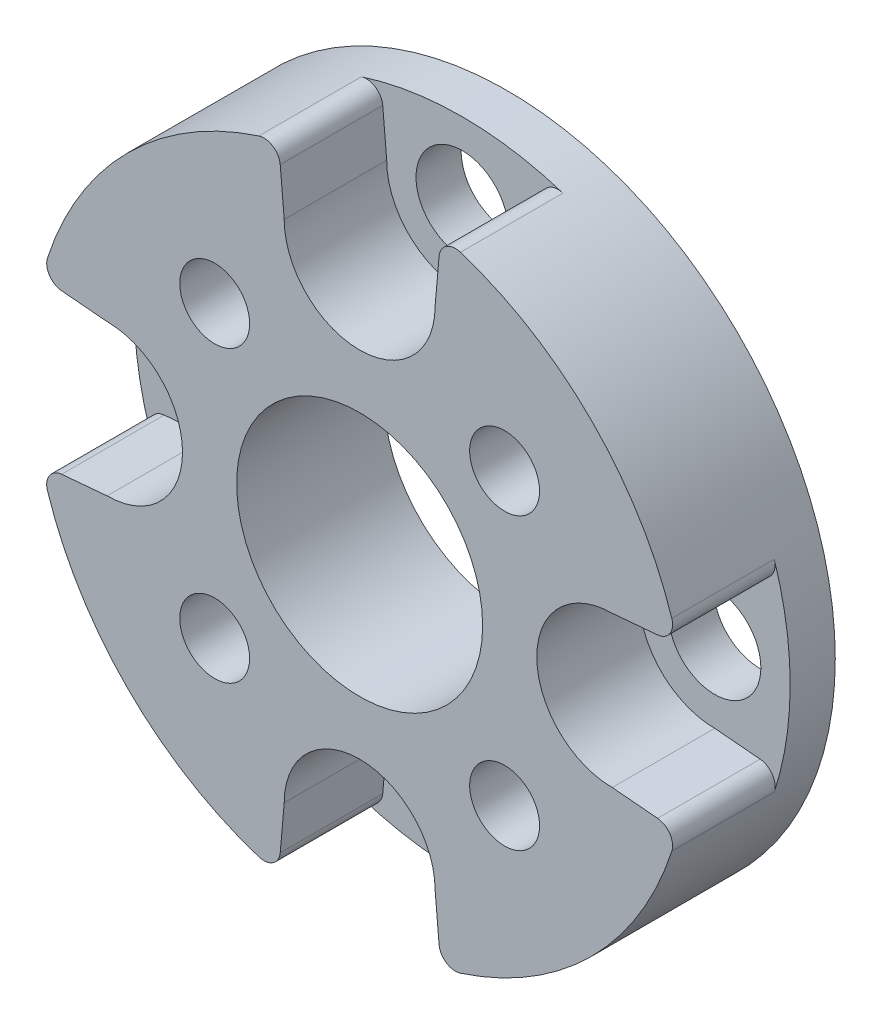
from build123d import *

# Parameters (mm, degrees)
SKETCH1_R                       = 12.7
SKETCH1_R_2                     = 4.7625
BOSS_EXTRUDE1_DEPTH             = 2.8575
F_6_32_TAPPED_HOLE1_D           = 2.7051
CUT_EXTRUDE1_DEPTH              = 3.96875
F_9_64_0_14063_DIAMETER_HOLE1_D = 3.572002
FILLET1_R                       = 0.635


with BuildPart() as part:
    # Sketch1 → Boss-Extrude1 (new, symmetric)
    with BuildSketch(Plane.XY):
        Circle(SKETCH1_R)
        Circle(SKETCH1_R_2, mode=Mode.SUBTRACT)
    extrude(amount=BOSS_EXTRUDE1_DEPTH, both=True)

    # #6-32 Tapped Hole1 (through all)
    with Locations(Plane.XY.offset(2.8575)):
        with Locations((5.612660076, 5.612660076), (5.612660076, -5.612660076), (-5.612660076, -5.612660076), (-5.612660076, 5.612660076)):
            Hole(F_6_32_TAPPED_HOLE1_D / 2)

    # Sketch5 → Cut-Extrude1 (cut)
    with BuildSketch(Plane.XY.offset(2.8575)):
        with BuildLine():
            Line((9.779, 2.921), (12.305192125, 3.142013173))
            ThreePointArc((12.305192125, 3.142013173), (12.7, 0), (12.305192125, -3.142013173))
            Line((12.305192125, -3.142013173), (9.779, -2.921))
            ThreePointArc((9.779, -2.921), (6.858, 0), (9.779, 2.921))
        make_face()
        with BuildLine():
            Line((2.921, -9.779), (3.142013173, -12.305192125))
            ThreePointArc((3.142013173, -12.305192125), (0, -12.7), (-3.142013173, -12.305192125))
            Line((-3.142013173, -12.305192125), (-2.921, -9.779))
            ThreePointArc((-2.921, -9.779), (0, -6.858), (2.921, -9.779))
        make_face()
        with BuildLine():
            Line((-9.779, -2.921), (-12.305192125, -3.142013173))
            ThreePointArc((-12.305192125, -3.142013173), (-12.7, 0), (-12.305192125, 3.142013173))
            Line((-12.305192125, 3.142013173), (-9.779, 2.921))
            ThreePointArc((-9.779, 2.921), (-6.858, 0), (-9.779, -2.921))
        make_face()
        with BuildLine():
            Line((-2.921, 9.779), (-3.142013173, 12.305192125))
            ThreePointArc((-3.142013173, 12.305192125), (0, 12.7), (3.142013173, 12.305192125))
            Line((3.142013173, 12.305192125), (2.921, 9.779))
            ThreePointArc((2.921, 9.779), (0, 6.858), (-2.921, 9.779))
        make_face()
    extrude(amount=-CUT_EXTRUDE1_DEPTH, mode=Mode.SUBTRACT)

    # 9/64 (0.14063) Diameter Hole1 (through all)
    with Locations(Plane.XY.offset(-1.11125)):
        with Locations((0, 9.779), (-9.779, 0), (0, -9.779), (9.779, 0)):
            Hole(F_9_64_0_14063_DIAMETER_HOLE1_D / 2)

    # Fillet1
    fillet1_edges = [part.edges().sort_by_distance(p)[0] for p in [
        (12.305192125, 3.142013173, 0.873125),
        (12.305192125, -3.142013173, 0.873125),
        (3.142013173, -12.305192125, 0.873125),
        (-3.142013173, -12.305192125, 0.873125),
        (-12.305192125, -3.142013173, 0.873125),
        (-12.305192125, 3.142013173, 0.873125),
        (-3.142013173, 12.305192125, 0.873125),
        (3.142013173, 12.305192125, 0.873125),
    ]]
    fillet(fillet1_edges, radius=FILLET1_R)


solid = part.part
